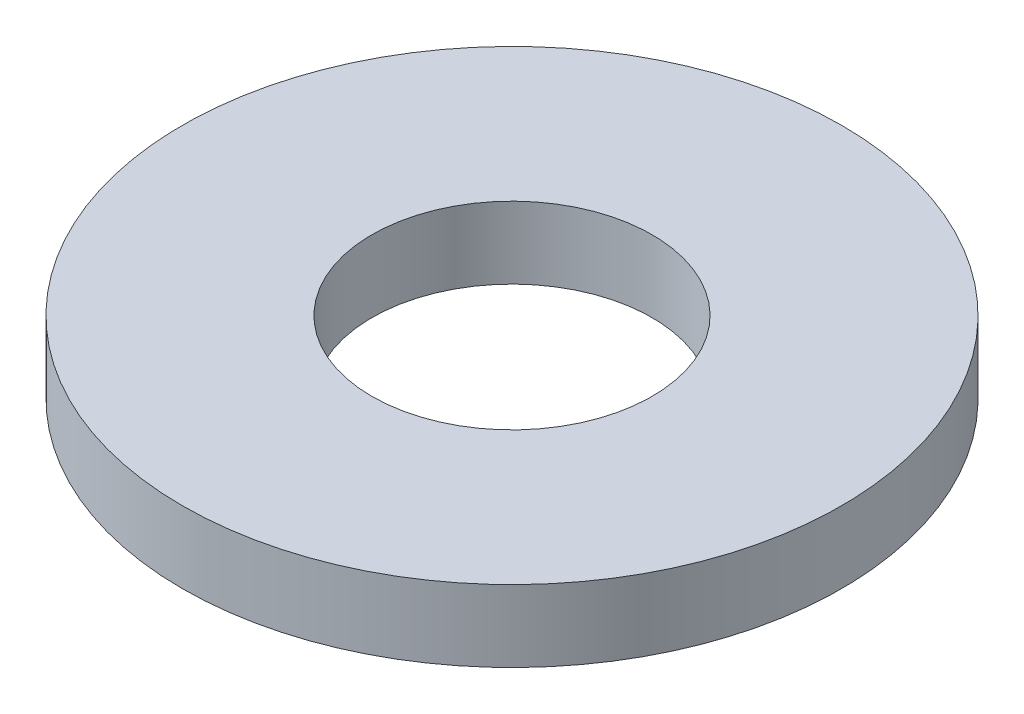
from build123d import *

# Parameters (mm, degrees)
SKETCH1_R           = 9.3218
BOSS_EXTRUDE1_DEPTH = 2.032
SKETCH5_R           = 3.9624
CUT_EXTRUDE1_DEPTH  = 14.338700629


with BuildPart() as part:
    # Sketch1 → Boss-Extrude1 (new body)
    with BuildSketch(Plane(origin=(0, 0, 0), x_dir=(1, 0, 0), z_dir=(0, 1, 0))):
        with Locations(Location((0, 0, 0), (0, 0, 270))):
            Circle(SKETCH1_R)
    extrude(amount=BOSS_EXTRUDE1_DEPTH)

    # Sketch5 → Cut-Extrude1 (cut, through all)
    with BuildSketch(Plane(origin=(0, 2.032, 0), x_dir=(-1, 0, 0), z_dir=(0, 1, 0))):
        with Locations(Location((0, 0, 0), (0, 0, 90))):
            Circle(SKETCH5_R)
    extrude(amount=-CUT_EXTRUDE1_DEPTH, mode=Mode.SUBTRACT)


solid = part.part
